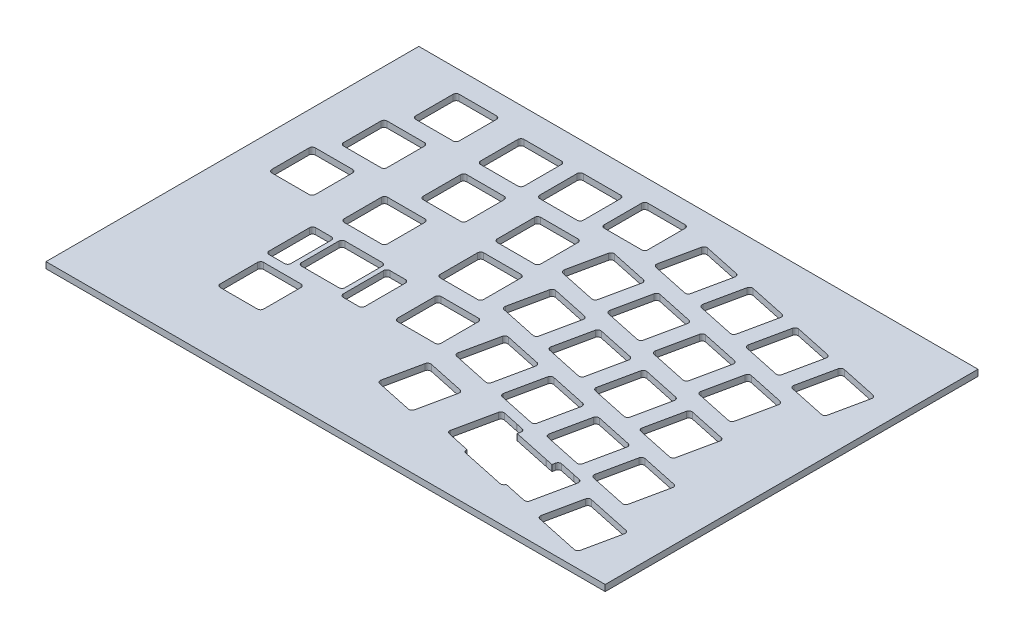
from build123d import *

# Parameters (mm, degrees)
SKETCH1_W           = 180
SKETCH1_H           = 120
BOSS_EXTRUDE1_DEPTH = 1


with BuildPart() as part:
    # Sketch1 → Boss-Extrude1 (new, symmetric)
    with BuildSketch(Plane(origin=(0, 0, 0), x_dir=(1, 0, 0), z_dir=(0, 1, 0))):
        with Locations((-87, 57)):
            Rectangle(SKETCH1_W, SKETCH1_H)
        with BuildLine():
            Line((-26.858427678, 37.742163713), (-29.353367968, 26.004392505))
            ThreePointArc((-29.353367968, 26.004392505), (-29.213890935, 25.251841779), (-28.583132058, 24.818333213))
            Line((-28.583132058, 24.818333213), (-16.845360849, 22.323392923))
            ThreePointArc((-16.845360849, 22.323392923), (-16.092810124, 22.462869956), (-15.659301558, 23.093628833))
            Line((-15.659301558, 23.093628833), (-13.164361268, 34.831400042))
            ThreePointArc((-13.164361268, 34.831400042), (-13.303838301, 35.583950768), (-13.934597178, 36.017459334))
            Line((-13.934597178, 36.017459334), (-25.672368387, 38.512399623))
            ThreePointArc((-25.672368387, 38.512399623), (-26.424919113, 38.372922591), (-26.858427678, 37.742163713))
        make_face(mode=Mode.SUBTRACT)
        with BuildLine():
            Line((-32.208427678, 58.352163713), (-34.703367968, 46.614392505))
            ThreePointArc((-34.703367968, 46.614392505), (-34.563890935, 45.861841779), (-33.933132058, 45.428333213))
            Line((-33.933132058, 45.428333213), (-22.195360849, 42.933392923))
            ThreePointArc((-22.195360849, 42.933392923), (-21.442810124, 43.072869956), (-21.009301558, 43.703628833))
            Line((-21.009301558, 43.703628833), (-18.514361268, 55.441400042))
            ThreePointArc((-18.514361268, 55.441400042), (-18.653838301, 56.193950768), (-19.284597178, 56.627459334))
            Line((-19.284597178, 56.627459334), (-31.022368387, 59.122399623))
            ThreePointArc((-31.022368387, 59.122399623), (-31.774919113, 58.982922591), (-32.208427678, 58.352163713))
        make_face(mode=Mode.SUBTRACT)
        with BuildLine():
            Line((-32.908427678, 77.982163713), (-35.403367968, 66.244392505))
            ThreePointArc((-35.403367968, 66.244392505), (-35.263890935, 65.491841779), (-34.633132058, 65.058333213))
            Line((-34.633132058, 65.058333213), (-22.895360849, 62.563392923))
            ThreePointArc((-22.895360849, 62.563392923), (-22.142810124, 62.702869956), (-21.709301558, 63.333628833))
            Line((-21.709301558, 63.333628833), (-19.214361268, 75.071400042))
            ThreePointArc((-19.214361268, 75.071400042), (-19.353838301, 75.823950768), (-19.984597178, 76.257459334))
            Line((-19.984597178, 76.257459334), (-31.722368387, 78.752399623))
            ThreePointArc((-31.722368387, 78.752399623), (-32.474919113, 78.612922591), (-32.908427678, 77.982163713))
        make_face(mode=Mode.SUBTRACT)
        with BuildLine():
            Line((-19.628427678, 94.632163713), (-22.123367968, 82.894392505))
            ThreePointArc((-22.123367968, 82.894392505), (-21.983890935, 82.141841779), (-21.353132058, 81.708333213))
            Line((-21.353132058, 81.708333213), (-9.615360849, 79.213392923))
            ThreePointArc((-9.615360849, 79.213392923), (-8.862810124, 79.352869956), (-8.429301558, 79.983628833))
            Line((-8.429301558, 79.983628833), (-5.934361268, 91.721400042))
            ThreePointArc((-5.934361268, 91.721400042), (-6.073838301, 92.473950768), (-6.704597178, 92.907459334))
            Line((-6.704597178, 92.907459334), (-18.442368387, 95.402399623))
            ThreePointArc((-18.442368387, 95.402399623), (-19.194919113, 95.262922591), (-19.628427678, 94.632163713))
        make_face(mode=Mode.SUBTRACT)
        with BuildLine():
            Line((-45.492139472, 41.702881424), (-47.987079762, 29.965110215))
            ThreePointArc((-47.987079762, 29.965110215), (-47.847602729, 29.212559489), (-47.216843852, 28.779050923))
            Line((-47.216843852, 28.779050923), (-35.479072643, 26.284110633))
            ThreePointArc((-35.479072643, 26.284110633), (-34.726521918, 26.423587666), (-34.293013352, 27.054346543))
            Line((-34.293013352, 27.054346543), (-31.798073062, 38.792117752))
            ThreePointArc((-31.798073062, 38.792117752), (-31.937550095, 39.544668478), (-32.568308972, 39.978177044))
            Line((-32.568308972, 39.978177044), (-44.306080181, 42.473117333))
            ThreePointArc((-44.306080181, 42.473117333), (-45.058630907, 42.333640301), (-45.492139472, 41.702881424))
        make_face(mode=Mode.SUBTRACT)
        with BuildLine():
            Line((-50.842139472, 62.312881424), (-53.337079762, 50.575110215))
            ThreePointArc((-53.337079762, 50.575110215), (-53.197602729, 49.822559489), (-52.566843852, 49.389050923))
            Line((-52.566843852, 49.389050923), (-40.829072643, 46.894110633))
            ThreePointArc((-40.829072643, 46.894110633), (-40.076521918, 47.033587666), (-39.643013352, 47.664346543))
            Line((-39.643013352, 47.664346543), (-37.148073062, 59.402117752))
            ThreePointArc((-37.148073062, 59.402117752), (-37.287550095, 60.154668478), (-37.918308972, 60.588177044))
            Line((-37.918308972, 60.588177044), (-49.656080181, 63.083117333))
            ThreePointArc((-49.656080181, 63.083117333), (-50.408630907, 62.943640301), (-50.842139472, 62.312881424))
        make_face(mode=Mode.SUBTRACT)
        with BuildLine():
            Line((-51.542139472, 81.942881424), (-54.037079762, 70.205110215))
            ThreePointArc((-54.037079762, 70.205110215), (-53.897602729, 69.452559489), (-53.266843852, 69.019050923))
            Line((-53.266843852, 69.019050923), (-41.529072643, 66.524110633))
            ThreePointArc((-41.529072643, 66.524110633), (-40.776521918, 66.663587666), (-40.343013352, 67.294346543))
            Line((-40.343013352, 67.294346543), (-37.848073062, 79.032117752))
            ThreePointArc((-37.848073062, 79.032117752), (-37.987550095, 79.784668478), (-38.618308972, 80.218177044))
            Line((-38.618308972, 80.218177044), (-50.356080181, 82.713117333))
            ThreePointArc((-50.356080181, 82.713117333), (-51.108630907, 82.573640301), (-51.542139472, 81.942881424))
        make_face(mode=Mode.SUBTRACT)
        with BuildLine():
            Line((-38.262139472, 98.592881424), (-40.757079762, 86.855110215))
            ThreePointArc((-40.757079762, 86.855110215), (-40.617602729, 86.102559489), (-39.986843852, 85.669050923))
            Line((-39.986843852, 85.669050923), (-28.249072643, 83.174110633))
            ThreePointArc((-28.249072643, 83.174110633), (-27.496521918, 83.313587666), (-27.063013352, 83.944346543))
            Line((-27.063013352, 83.944346543), (-24.568073062, 95.682117752))
            ThreePointArc((-24.568073062, 95.682117752), (-24.707550095, 96.434668478), (-25.338308972, 96.868177044))
            Line((-25.338308972, 96.868177044), (-37.076080181, 99.363117333))
            ThreePointArc((-37.076080181, 99.363117333), (-37.828630907, 99.223640301), (-38.262139472, 98.592881424))
        make_face(mode=Mode.SUBTRACT)
        with BuildLine():
            Line((-64.125851266, 45.663599134), (-66.620791556, 33.925827925))
            ThreePointArc((-66.620791556, 33.925827925), (-66.481314523, 33.173277199), (-65.850555646, 32.739768633))
            Line((-65.850555646, 32.739768633), (-54.112784437, 30.244828343))
            ThreePointArc((-54.112784437, 30.244828343), (-53.360233712, 30.384305376), (-52.926725146, 31.015064253))
            Line((-52.926725146, 31.015064253), (-50.431784856, 42.752835462))
            ThreePointArc((-50.431784856, 42.752835462), (-50.571261889, 43.505386188), (-51.202020766, 43.938894754))
            Line((-51.202020766, 43.938894754), (-62.939791975, 46.433835044))
            ThreePointArc((-62.939791975, 46.433835044), (-63.692342701, 46.294358011), (-64.125851266, 45.663599134))
        make_face(mode=Mode.SUBTRACT)
        with BuildLine():
            Line((-69.475851266, 66.273599134), (-71.970791556, 54.535827925))
            ThreePointArc((-71.970791556, 54.535827925), (-71.831314523, 53.783277199), (-71.200555646, 53.349768633))
            Line((-71.200555646, 53.349768633), (-59.462784437, 50.854828343))
            ThreePointArc((-59.462784437, 50.854828343), (-58.710233712, 50.994305376), (-58.276725146, 51.625064253))
            Line((-58.276725146, 51.625064253), (-55.781784856, 63.362835462))
            ThreePointArc((-55.781784856, 63.362835462), (-55.921261889, 64.115386188), (-56.552020766, 64.548894754))
            Line((-56.552020766, 64.548894754), (-68.289791975, 67.043835044))
            ThreePointArc((-68.289791975, 67.043835044), (-69.042342701, 66.904358011), (-69.475851266, 66.273599134))
        make_face(mode=Mode.SUBTRACT)
        with BuildLine():
            Line((-70.175851266, 85.903599134), (-72.670791556, 74.165827925))
            ThreePointArc((-72.670791556, 74.165827925), (-72.531314523, 73.413277199), (-71.900555646, 72.979768633))
            Line((-71.900555646, 72.979768633), (-60.162784437, 70.484828343))
            ThreePointArc((-60.162784437, 70.484828343), (-59.410233712, 70.624305376), (-58.976725146, 71.255064253))
            Line((-58.976725146, 71.255064253), (-56.481784856, 82.992835462))
            ThreePointArc((-56.481784856, 82.992835462), (-56.621261889, 83.745386188), (-57.252020766, 84.178894754))
            Line((-57.252020766, 84.178894754), (-68.989791975, 86.673835044))
            ThreePointArc((-68.989791975, 86.673835044), (-69.742342701, 86.534358011), (-70.175851266, 85.903599134))
        make_face(mode=Mode.SUBTRACT)
        with BuildLine():
            Line((-56.895851266, 102.553599134), (-59.390791556, 90.815827925))
            ThreePointArc((-59.390791556, 90.815827925), (-59.251314523, 90.063277199), (-58.620555646, 89.629768633))
            Line((-58.620555646, 89.629768633), (-46.882784437, 87.134828343))
            ThreePointArc((-46.882784437, 87.134828343), (-46.130233712, 87.274305376), (-45.696725146, 87.905064253))
            Line((-45.696725146, 87.905064253), (-43.201784856, 99.642835462))
            ThreePointArc((-43.201784856, 99.642835462), (-43.341261889, 100.395386188), (-43.972020766, 100.828894754))
            Line((-43.972020766, 100.828894754), (-55.709791975, 103.323835044))
            ThreePointArc((-55.709791975, 103.323835044), (-56.462342701, 103.184358011), (-56.895851266, 102.553599134))
        make_face(mode=Mode.SUBTRACT)
        with BuildLine():
            Line((-88.10956306, 70.234316844), (-90.60450335, 58.496545635))
            ThreePointArc((-90.60450335, 58.496545635), (-90.465026317, 57.743994909), (-89.83426744, 57.310486343))
            Line((-89.83426744, 57.310486343), (-78.096496231, 54.815546054))
            ThreePointArc((-78.096496231, 54.815546054), (-77.343945505, 54.955023086), (-76.91043694, 55.585781963))
            Line((-76.91043694, 55.585781963), (-74.41549665, 67.323553172))
            ThreePointArc((-74.41549665, 67.323553172), (-74.554973683, 68.076103898), (-75.18573256, 68.509612464))
            Line((-75.18573256, 68.509612464), (-86.923503769, 71.004552754))
            ThreePointArc((-86.923503769, 71.004552754), (-87.676054495, 70.865075721), (-88.10956306, 70.234316844))
        make_face(mode=Mode.SUBTRACT)
        with BuildLine():
            Line((-82.75956306, 49.624316844), (-85.25450335, 37.886545635))
            ThreePointArc((-85.25450335, 37.886545635), (-85.115026317, 37.133994909), (-84.48426744, 36.700486343))
            Line((-84.48426744, 36.700486343), (-72.746496231, 34.205546054))
            ThreePointArc((-72.746496231, 34.205546054), (-71.993945505, 34.345023086), (-71.56043694, 34.975781963))
            Line((-71.56043694, 34.975781963), (-69.06549665, 46.713553172))
            ThreePointArc((-69.06549665, 46.713553172), (-69.204973683, 47.466103898), (-69.83573256, 47.899612464))
            Line((-69.83573256, 47.899612464), (-81.573503769, 50.394552754))
            ThreePointArc((-81.573503769, 50.394552754), (-82.326054495, 50.255075721), (-82.75956306, 49.624316844))
        make_face(mode=Mode.SUBTRACT)
        with BuildLine():
            Line((-87.56956306, 29.634316844), (-90.06450335, 17.896545635))
            ThreePointArc((-90.06450335, 17.896545635), (-89.925026317, 17.143994909), (-89.29426744, 16.710486343))
            Line((-89.29426744, 16.710486343), (-77.556496231, 14.215546054))
            ThreePointArc((-77.556496231, 14.215546054), (-76.803945505, 14.355023086), (-76.37043694, 14.985781963))
            Line((-76.37043694, 14.985781963), (-73.87549665, 26.723553172))
            ThreePointArc((-73.87549665, 26.723553172), (-74.014973683, 27.476103898), (-74.64573256, 27.909612464))
            Line((-74.64573256, 27.909612464), (-86.383503769, 30.404552754))
            ThreePointArc((-86.383503769, 30.404552754), (-87.136054495, 30.265075721), (-87.56956306, 29.634316844))
        make_face(mode=Mode.SUBTRACT)
        with BuildLine():
            Line((-88.80956306, 89.864316844), (-91.30450335, 78.126545635))
            ThreePointArc((-91.30450335, 78.126545635), (-91.165026317, 77.373994909), (-90.53426744, 76.940486343))
            Line((-90.53426744, 76.940486343), (-78.796496231, 74.445546054))
            ThreePointArc((-78.796496231, 74.445546054), (-78.043945505, 74.585023086), (-77.61043694, 75.215781963))
            Line((-77.61043694, 75.215781963), (-75.11549665, 86.953553172))
            ThreePointArc((-75.11549665, 86.953553172), (-75.254973683, 87.706103898), (-75.88573256, 88.139612464))
            Line((-75.88573256, 88.139612464), (-87.623503769, 90.634552754))
            ThreePointArc((-87.623503769, 90.634552754), (-88.376054495, 90.495075721), (-88.80956306, 89.864316844))
        make_face(mode=Mode.SUBTRACT)
        with BuildLine():
            Line((-75.52956306, 106.514316844), (-78.02450335, 94.776545635))
            ThreePointArc((-78.02450335, 94.776545635), (-77.885026317, 94.023994909), (-77.25426744, 93.590486343))
            Line((-77.25426744, 93.590486343), (-65.516496231, 91.095546054))
            ThreePointArc((-65.516496231, 91.095546054), (-64.763945505, 91.235023086), (-64.33043694, 91.865781963))
            Line((-64.33043694, 91.865781963), (-61.83549665, 103.603553172))
            ThreePointArc((-61.83549665, 103.603553172), (-61.974973683, 104.356103898), (-62.60573256, 104.789612464))
            Line((-62.60573256, 104.789612464), (-74.343503769, 107.284552754))
            ThreePointArc((-74.343503769, 107.284552754), (-75.096054495, 107.145075721), (-75.52956306, 106.514316844))
        make_face(mode=Mode.SUBTRACT)
        with BuildLine():
            Line((-110.01, 68.910049404), (-110.01, 56.910049404))
            ThreePointArc((-110.01, 56.910049404), (-109.717106781, 56.202942622), (-109.01, 55.910049404))
            Line((-109.01, 55.910049404), (-97.01, 55.910049404))
            ThreePointArc((-97.01, 55.910049404), (-96.302893219, 56.202942622), (-96.01, 56.910049404))
            Line((-96.01, 56.910049404), (-96.01, 68.910049404))
            ThreePointArc((-96.01, 68.910049404), (-96.302893219, 69.617156185), (-97.01, 69.910049404))
            Line((-97.01, 69.910049404), (-109.01, 69.910049404))
            ThreePointArc((-109.01, 69.910049404), (-109.717106781, 69.617156185), (-110.01, 68.910049404))
        make_face(mode=Mode.SUBTRACT)
        with BuildLine():
            Line((-134.52, 87.960049404), (-134.52, 75.960049404))
            ThreePointArc((-134.52, 75.960049404), (-134.227106781, 75.252942622), (-133.52, 74.960049404))
            Line((-133.52, 74.960049404), (-121.52, 74.960049404))
            ThreePointArc((-121.52, 74.960049404), (-120.812893219, 75.252942622), (-120.52, 75.960049404))
            Line((-120.52, 75.960049404), (-120.52, 87.960049404))
            ThreePointArc((-120.52, 87.960049404), (-120.812893219, 88.667156185), (-121.52, 88.960049404))
            Line((-121.52, 88.960049404), (-133.52, 88.960049404))
            ThreePointArc((-133.52, 88.960049404), (-134.227106781, 88.667156185), (-134.52, 87.960049404))
        make_face(mode=Mode.SUBTRACT)
        with BuildLine():
            Line((-140.97, 68.910049404), (-140.97, 56.910049404))
            ThreePointArc((-140.97, 56.910049404), (-140.677106781, 56.202942622), (-139.97, 55.910049404))
            Line((-139.97, 55.910049404), (-127.97, 55.910049404))
            ThreePointArc((-127.97, 55.910049404), (-127.262893219, 56.202942622), (-126.97, 56.910049404))
            Line((-126.97, 56.910049404), (-126.97, 68.910049404))
            ThreePointArc((-126.97, 68.910049404), (-127.262893219, 69.617156185), (-127.97, 69.910049404))
            Line((-127.97, 69.910049404), (-139.97, 69.910049404))
            ThreePointArc((-139.97, 69.910049404), (-140.677106781, 69.617156185), (-140.97, 68.910049404))
        make_face(mode=Mode.SUBTRACT)
        with BuildLine():
            Line((-110.71, 87.960049404), (-110.71, 75.960049404))
            ThreePointArc((-110.71, 75.960049404), (-110.417106781, 75.252942622), (-109.71, 74.960049404))
            Line((-109.71, 74.960049404), (-97.71, 74.960049404))
            ThreePointArc((-97.71, 74.960049404), (-97.002893219, 75.252942622), (-96.71, 75.960049404))
            Line((-96.71, 75.960049404), (-96.71, 87.960049404))
            ThreePointArc((-96.71, 87.960049404), (-97.002893219, 88.667156185), (-97.71, 88.960049404))
            Line((-97.71, 88.960049404), (-109.71, 88.960049404))
            ThreePointArc((-109.71, 88.960049404), (-110.417106781, 88.667156185), (-110.71, 87.960049404))
        make_face(mode=Mode.SUBTRACT)
        with BuildLine():
            Line((-97.43, 109.150049404), (-97.43, 97.150049404))
            ThreePointArc((-97.43, 97.150049404), (-97.137106781, 96.442942622), (-96.43, 96.150049404))
            Line((-96.43, 96.150049404), (-84.43, 96.150049404))
            ThreePointArc((-84.43, 96.150049404), (-83.722893219, 96.442942622), (-83.43, 97.150049404))
            Line((-83.43, 97.150049404), (-83.43, 109.150049404))
            ThreePointArc((-83.43, 109.150049404), (-83.722893219, 109.857156185), (-84.43, 110.150049404))
            Line((-84.43, 110.150049404), (-96.43, 110.150049404))
            ThreePointArc((-96.43, 110.150049404), (-97.137106781, 109.857156185), (-97.43, 109.150049404))
        make_face(mode=Mode.SUBTRACT)
        with BuildLine():
            Line((-116.07, 107.010049404), (-116.07, 95.010049404))
            ThreePointArc((-116.07, 95.010049404), (-115.777106781, 94.302942622), (-115.07, 94.010049404))
            Line((-115.07, 94.010049404), (-103.07, 94.010049404))
            ThreePointArc((-103.07, 94.010049404), (-102.362893219, 94.302942622), (-102.07, 95.010049404))
            Line((-102.07, 95.010049404), (-102.07, 107.010049404))
            ThreePointArc((-102.07, 107.010049404), (-102.362893219, 107.717156185), (-103.07, 108.010049404))
            Line((-103.07, 108.010049404), (-115.07, 108.010049404))
            ThreePointArc((-115.07, 108.010049404), (-115.777106781, 107.717156185), (-116.07, 107.010049404))
        make_face(mode=Mode.SUBTRACT)
        with BuildLine():
            Line((-135.12, 107.010049404), (-135.12, 95.010049404))
            ThreePointArc((-135.12, 95.010049404), (-134.827106781, 94.302942622), (-134.12, 94.010049404))
            Line((-134.12, 94.010049404), (-122.12, 94.010049404))
            ThreePointArc((-122.12, 94.010049404), (-121.412893219, 94.302942622), (-121.12, 95.010049404))
            Line((-121.12, 95.010049404), (-121.12, 107.010049404))
            ThreePointArc((-121.12, 107.010049404), (-121.412893219, 107.717156185), (-122.12, 108.010049404))
            Line((-122.12, 108.010049404), (-134.12, 108.010049404))
            ThreePointArc((-134.12, 108.010049404), (-134.827106781, 107.717156185), (-135.12, 107.010049404))
        make_face(mode=Mode.SUBTRACT)
        with BuildLine():
            Line((-104.66, 49.860049404), (-104.66, 37.860049404))
            ThreePointArc((-104.66, 37.860049404), (-104.367106781, 37.152942622), (-103.66, 36.860049404))
            Line((-103.66, 36.860049404), (-91.66, 36.860049404))
            ThreePointArc((-91.66, 36.860049404), (-90.952893219, 37.152942622), (-90.66, 37.860049404))
            Line((-90.66, 37.860049404), (-90.66, 49.860049404))
            ThreePointArc((-90.66, 49.860049404), (-90.952893219, 50.567156185), (-91.66, 50.860049404))
            Line((-91.66, 50.860049404), (-103.66, 50.860049404))
            ThreePointArc((-103.66, 50.860049404), (-104.367106781, 50.567156185), (-104.66, 49.860049404))
        make_face(mode=Mode.SUBTRACT)
        with BuildLine():
            Line((-142.75, 30.810049404), (-142.75, 18.810049404))
            ThreePointArc((-142.75, 18.810049404), (-142.457106781, 18.102942622), (-141.75, 17.810049404))
            Line((-141.75, 17.810049404), (-129.75, 17.810049404))
            ThreePointArc((-129.75, 17.810049404), (-129.042893219, 18.102942622), (-128.75, 18.810049404))
            Line((-128.75, 18.810049404), (-128.75, 30.810049404))
            ThreePointArc((-128.75, 30.810049404), (-129.042893219, 31.517156185), (-129.75, 31.810049404))
            Line((-129.75, 31.810049404), (-141.75, 31.810049404))
            ThreePointArc((-141.75, 31.810049404), (-142.457106781, 31.517156185), (-142.75, 30.810049404))
        make_face(mode=Mode.SUBTRACT)
        with BuildLine():
            Line((-158.14, 109.150049404), (-158.14, 97.150049404))
            ThreePointArc((-158.14, 97.150049404), (-157.847106781, 96.442942622), (-157.14, 96.150049404))
            Line((-157.14, 96.150049404), (-145.14, 96.150049404))
            ThreePointArc((-145.14, 96.150049404), (-144.432893219, 96.442942622), (-144.14, 97.150049404))
            Line((-144.14, 97.150049404), (-144.14, 109.150049404))
            ThreePointArc((-144.14, 109.150049404), (-144.432893219, 109.857156185), (-145.14, 110.150049404))
            Line((-145.14, 110.150049404), (-157.14, 110.150049404))
            ThreePointArc((-157.14, 110.150049404), (-157.847106781, 109.857156185), (-158.14, 109.150049404))
        make_face(mode=Mode.SUBTRACT)
        with BuildLine():
            Line((-162.3, 90.100049404), (-162.3, 78.100049404))
            ThreePointArc((-162.3, 78.100049404), (-162.007106781, 77.392942622), (-161.3, 77.100049404))
            Line((-161.3, 77.100049404), (-149.3, 77.100049404))
            ThreePointArc((-149.3, 77.100049404), (-148.592893219, 77.392942622), (-148.3, 78.100049404))
            Line((-148.3, 78.100049404), (-148.3, 90.100049404))
            ThreePointArc((-148.3, 90.100049404), (-148.592893219, 90.807156185), (-149.3, 91.100049404))
            Line((-149.3, 91.100049404), (-161.3, 91.100049404))
            ThreePointArc((-161.3, 91.100049404), (-162.007106781, 90.807156185), (-162.3, 90.100049404))
        make_face(mode=Mode.SUBTRACT)
        with BuildLine():
            Line((-135.61, 49.860049404), (-135.61, 37.860049404))
            ThreePointArc((-135.61, 37.860049404), (-135.317106781, 37.152942622), (-134.61, 36.860049404))
            Line((-134.61, 36.860049404), (-122.61, 36.860049404))
            ThreePointArc((-122.61, 36.860049404), (-121.902893219, 37.152942622), (-121.61, 37.860049404))
            Line((-121.61, 37.860049404), (-121.61, 49.860049404))
            ThreePointArc((-121.61, 49.860049404), (-121.902893219, 50.567156185), (-122.61, 50.860049404))
            Line((-122.61, 50.860049404), (-134.61, 50.860049404))
            ThreePointArc((-134.61, 50.860049404), (-135.317106781, 50.567156185), (-135.61, 49.860049404))
        make_face(mode=Mode.SUBTRACT)
        with BuildLine():
            Line((-166.37, 71.050049404), (-166.37, 59.050049404))
            ThreePointArc((-166.37, 59.050049404), (-166.077106781, 58.342942622), (-165.37, 58.050049404))
            Line((-165.37, 58.050049404), (-153.37, 58.050049404))
            ThreePointArc((-153.37, 58.050049404), (-152.662893219, 58.342942622), (-152.37, 59.050049404))
            Line((-152.37, 59.050049404), (-152.37, 71.050049404))
            ThreePointArc((-152.37, 71.050049404), (-152.662893219, 71.757156185), (-153.37, 72.050049404))
            Line((-153.37, 72.050049404), (-165.37, 72.050049404))
            ThreePointArc((-165.37, 72.050049404), (-166.077106781, 71.757156185), (-166.37, 71.050049404))
        make_face(mode=Mode.SUBTRACT)
        with BuildLine():
            Line((-113.172, 35.860049105), (-113.172, 48.860049105))
            ThreePointArc((-113.172, 48.860049105), (-113.464893219, 49.567155887), (-114.172, 49.860049105))
            Line((-114.172, 49.860049105), (-119.172, 49.860049105))
            ThreePointArc((-119.172, 49.860049105), (-119.879106781, 49.567155887), (-120.172, 48.860049105))
            Line((-120.172, 48.860049105), (-120.172, 35.860049105))
            ThreePointArc((-120.172, 35.860049105), (-119.879106781, 35.152942324), (-119.172, 34.860049105))
            Line((-119.172, 34.860049105), (-114.172, 34.860049105))
            ThreePointArc((-114.172, 34.860049105), (-113.464893219, 35.152942324), (-113.172, 35.860049105))
        make_face(mode=Mode.SUBTRACT)
        with BuildLine():
            Line((-137.048, 35.860049105), (-137.048, 48.860049105))
            ThreePointArc((-137.048, 48.860049105), (-137.340893219, 49.567155887), (-138.048, 49.860049105))
            Line((-138.048, 49.860049105), (-143.048, 49.860049105))
            ThreePointArc((-143.048, 49.860049105), (-143.755106781, 49.567155887), (-144.048, 48.860049105))
            Line((-144.048, 48.860049105), (-144.048, 35.860049105))
            ThreePointArc((-144.048, 35.860049105), (-143.755106781, 35.152942324), (-143.048, 34.860049105))
            Line((-143.048, 34.860049105), (-138.048, 34.860049105))
            ThreePointArc((-138.048, 34.860049105), (-137.340893219, 35.152942324), (-137.048, 35.860049105))
        make_face(mode=Mode.SUBTRACT)
        with BuildLine():
            Line((-53.76426744, 10.690486343), (-42.026496231, 8.195546054))
            ThreePointArc((-42.026496231, 8.195546054), (-41.273945505, 8.335023086), (-40.84043694, 8.965781963))
            Line((-40.84043694, 8.965781963), (-40.837928836, 8.977581665))
            ThreePointArc((-40.837928836, 8.977581665), (-40.790153642, 8.963631236), (-40.741743518, 8.952075135))
            Line((-40.741743518, 8.952075135), (-38.570684294, 8.490602251))
            ThreePointArc((-38.570684294, 8.490602251), (-38.513671794, 8.473032388), (-38.455713027, 8.458893553))
            Line((-38.455713027, 8.458893553), (-33.564975024, 7.419335099))
            ThreePointArc((-33.564975024, 7.419335099), (-32.812424298, 7.558812132), (-32.378915732, 8.189571009))
            Line((-32.378915732, 8.189571009), (-29.676063751, 20.905489818))
            ThreePointArc((-29.676063751, 20.905489818), (-29.815540784, 21.658040544), (-30.446299661, 22.09154911))
            Line((-30.446299661, 22.09154911), (-32.617358886, 22.553021994))
            ThreePointArc((-32.617358886, 22.553021994), (-32.674371386, 22.570591857), (-32.732330152, 22.584730692))
            Line((-32.732330152, 22.584730692), (-37.623068156, 23.624289146))
            ThreePointArc((-37.623068156, 23.624289146), (-38.375618882, 23.484812114), (-38.809127448, 22.854053236))
            Line((-38.809127448, 22.854053236), (-39.019547243, 21.864105934))
            ThreePointArc((-39.019547243, 21.864105934), (-39.067322436, 21.878056363), (-39.11573256, 21.889612464))
            Line((-39.11573256, 21.889612464), (-41.314298745, 22.356932133))
            ThreePointArc((-41.314298745, 22.356932133), (-41.360442389, 22.370275799), (-41.407173568, 22.381388236))
            Line((-41.407173568, 22.381388236), (-53.144944777, 24.876328525))
            ThreePointArc((-53.144944777, 24.876328525), (-53.191390549, 24.885059214), (-53.238196944, 24.891585773))
            Line((-53.238196944, 24.891585773), (-53.030315866, 25.869589348))
            ThreePointArc((-53.030315866, 25.869589348), (-53.169792899, 26.622140074), (-53.800551776, 27.05564864))
            Line((-53.800551776, 27.05564864), (-55.971611001, 27.517121524))
            ThreePointArc((-55.971611001, 27.517121524), (-56.028623501, 27.534691387), (-56.086582268, 27.548830222))
            Line((-56.086582268, 27.548830222), (-60.977320271, 28.588388676))
            ThreePointArc((-60.977320271, 28.588388676), (-61.729870997, 28.448911644), (-62.163379563, 27.818152766))
            Line((-62.163379563, 27.818152766), (-64.866231543, 15.102233957))
            ThreePointArc((-64.866231543, 15.102233957), (-64.726754511, 14.349683231), (-64.095995634, 13.916174665))
            Line((-64.095995634, 13.916174665), (-61.924936409, 13.454701781))
            ThreePointArc((-61.924936409, 13.454701781), (-61.867923909, 13.437131918), (-61.809965142, 13.422993083))
            Line((-61.809965142, 13.422993083), (-56.919227139, 12.383434629))
            ThreePointArc((-56.919227139, 12.383434629), (-56.872781362, 12.37470394), (-56.825974961, 12.36817738))
            ThreePointArc((-56.825974961, 12.36817738), (-56.686427226, 11.615708938), (-56.055708449, 11.182262115))
            Line((-56.055708449, 11.182262115), (-53.857142263, 10.714942446))
            ThreePointArc((-53.857142263, 10.714942446), (-53.810998619, 10.70159878), (-53.76426744, 10.690486343))
        make_face(mode=Mode.SUBTRACT)
        with BuildLine():
            Line((-24.04755435, 17.669146668), (-26.54249464, 5.931375459))
            ThreePointArc((-26.54249464, 5.931375459), (-26.403017607, 5.178824733), (-25.77225873, 4.745316167))
            Line((-25.77225873, 4.745316167), (-11.706496231, 1.755546054))
            ThreePointArc((-11.706496231, 1.755546054), (-10.953945505, 1.895023086), (-10.52043694, 2.525781963))
            Line((-10.52043694, 2.525781963), (-8.02549665, 14.263553172))
            ThreePointArc((-8.02549665, 14.263553172), (-8.164973683, 15.016103898), (-8.79573256, 15.449612464))
            Line((-8.79573256, 15.449612464), (-22.861495058, 18.439382578))
            ThreePointArc((-22.861495058, 18.439382578), (-23.614045784, 18.299905545), (-24.04755435, 17.669146668))
        make_face(mode=Mode.SUBTRACT)
    extrude(amount=BOSS_EXTRUDE1_DEPTH, both=True)


solid = part.part
